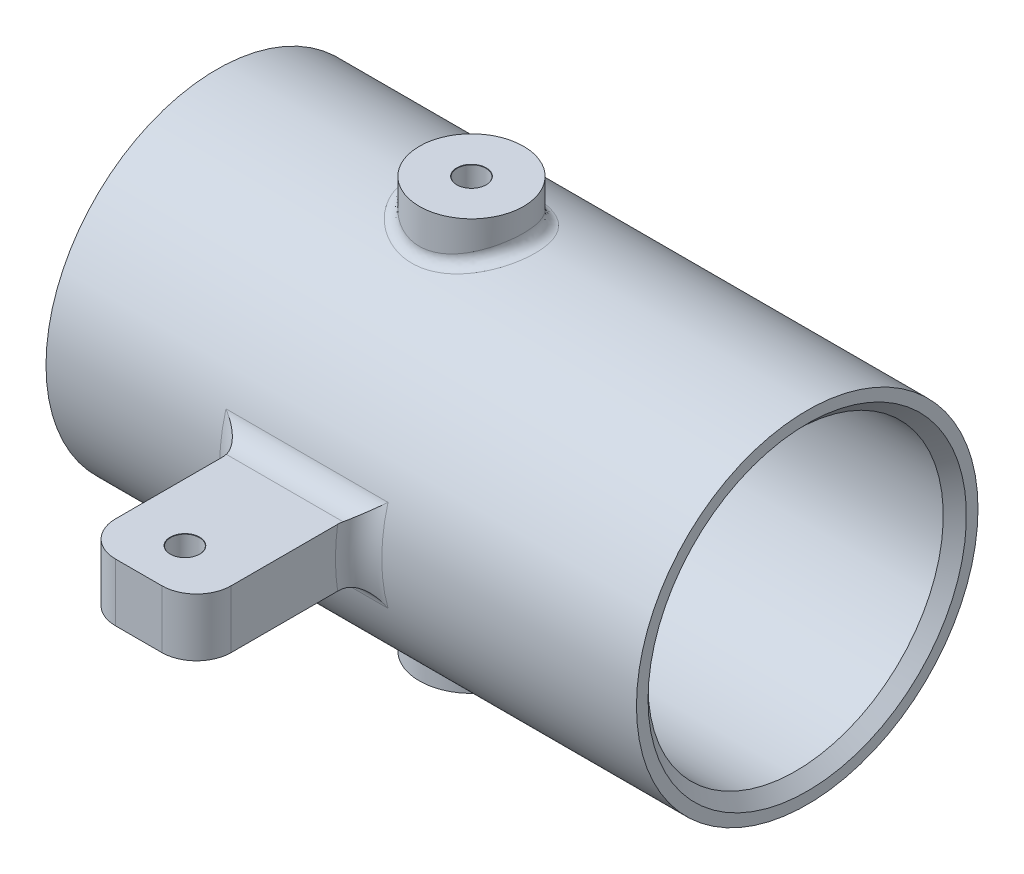
from build123d import *

# Parameters (mm, degrees)
M3_CLEARANCE_HOLE1_AT_2_COUNT = 2
M3_CLEARANCE_HOLE1_AT_2_PITCH = 17
BOSS_EXTRUDE2_START           = -0.703203
SKETCH5_R                     = 4.5
BOSS_EXTRUDE2_DEPTH           = 3.703203
SKETCH6_R                     = 1
CUT_EXTRUDE1_DEPTH            = 63.247992093
FILLET1_R                     = 1
SKETCH7_R                     = 1
BOSS_EXTRUDE3_DEPTH           = 2.5
BOSS_EXTRUDE4_REACH           = 63.533
BOSS_EXTRUDE4_END_RADIUS      = 14.75
SKETCH8_W                     = 10
SKETCH8_H                     = 5
CHAMFER1_SIZE                 = 1
CHAMFER2_SIZE                 = 0.5
FILLET2_R                     = 2


with BuildPart() as part:
    # Sketch1 → Revolve1 (revolve)
    with BuildSketch(Plane.XY, mode=Mode.PRIVATE) as revolve1_sk:
        Polygon((0, 3.75), (0, 14.75), (51, 14.75), (51, 12.75), (2, 12.75), (2, 3.75), align=None)
    revolve(revolve1_sk.sketch.rotate(Axis((-25.375, 0, 0), (1, 0, 0)), 90), axis=Axis((-25.375, 0, 0), (1, 0, 0)))

    # Sketch4 → M3 Clearance Hole1 (revolve, cut)
    with BuildSketch(Plane(origin=(0, 0, -8.5), x_dir=(0, 0, 1), z_dir=(0, 1, 0))):
        Polygon((0, 0), (0, 2), (1.825, 2), (1.8, 1.975), (1.8, 0.025), (1.825, 0), align=None)
    m3_clearance_hole1 = revolve(axis=Axis((-6.35, 0, -8.5), (1, 0, 0)), mode=Mode.SUBTRACT)

    # M3 Clearance Hole1 at 2: M3 Clearance Hole1 ×2
    with Locations(*[(0, 0, i * M3_CLEARANCE_HOLE1_AT_2_PITCH) for i in range(1, M3_CLEARANCE_HOLE1_AT_2_COUNT)]):
        add(m3_clearance_hole1, mode=Mode.SUBTRACT)

    # Sketch5 → Boss-Extrude2 (add)
    with BuildSketch(Plane(origin=(0, 14.75, 0), x_dir=(1, 0, 0), z_dir=(0, 1, 0)).offset(BOSS_EXTRUDE2_START)):
        with Locations(Location((22, 0, 0), (0, 0, 90))):
            Circle(SKETCH5_R)
    boss_extrude2 = extrude(amount=BOSS_EXTRUDE2_DEPTH)

    # Sketch6 → Cut-Extrude1 (cut, through all)
    with BuildSketch(Plane(origin=(0, 17.75, 0), x_dir=(1, 0, 0), z_dir=(0, 1, 0))):
        with Locations(Location((22, 0, 0), (0, 0, 270))):
            Circle(SKETCH6_R)
    cut_extrude1 = extrude(amount=-CUT_EXTRUDE1_DEPTH, mode=Mode.SUBTRACT)

    # Mirror1: Boss-Extrude2, Cut-Extrude1 across plane
    add(boss_extrude2.mirror(Plane.ZX))
    add(cut_extrude1.mirror(Plane.ZX), mode=Mode.SUBTRACT)

    # Fillet1
    fillet1_edges = [part.edges().sort_by_distance(p)[0] for p in [
        (22, 14.04679679, 4.499999998),
        (22, -14.04679679, 4.499999998),
    ]]
    fillet(fillet1_edges, radius=FILLET1_R)



with BuildPart() as body_2:
    # Sketch7 → Boss-Extrude3 (new, symmetric)
    with BuildSketch(Plane(origin=(0, 0, 0), x_dir=(1, 0, 0), z_dir=(0, 1, 0))):
        with BuildLine():
            Line((17, -14.75), (17, -25.75))
            ThreePointArc((17, -25.75), (17.878679656, -27.871320344), (20, -28.75))
            Line((20, -28.75), (24, -28.75))
            ThreePointArc((24, -28.75), (26.121320344, -27.871320344), (27, -25.75))
            Line((27, -25.75), (27, -14.75))
            Line((27, -14.75), (17, -14.75))
        make_face()
        with Locations(Location((22, -24.75, 0), (0, 0, 270))):
            Circle(SKETCH7_R, mode=Mode.SUBTRACT)
    extrude(amount=BOSS_EXTRUDE3_DEPTH, both=True)


with BuildPart() as part_1:
    add(part.part)

    add(body_2.part)  # Boss-Extrude4 merges body 2
    # Boss-Extrude4: up to this cylinder (the profile starts outside it)
    boss_extrude4_end = Plane(origin=(22, 0, 0), z_dir=(-1, 0, 0)) * Cylinder(BOSS_EXTRUDE4_END_RADIUS, 157.566, mode=Mode.PRIVATE)
    # Sketch8 → Boss-Extrude4 (add, up to the surface)
    with BuildSketch(Plane(origin=(0, 0, 14.75), x_dir=(-1, 0, 0), z_dir=(0, 0, -1)), mode=Mode.PRIVATE) as boss_extrude4_sk1:
        with Locations((-22, 0)):
            Rectangle(SKETCH8_W, SKETCH8_H)
    boss_extrude4_tool1 = extrude(boss_extrude4_sk1.sketch, amount=BOSS_EXTRUDE4_REACH, mode=Mode.PRIVATE) - boss_extrude4_end
    add(boss_extrude4_tool1.solids().sort_by_distance((22, 0, 14.75))[0])
    add(boss_extrude4_tool1.solids().sort_by_distance((22, 0, 14.75))[1])

    # Sketch11 → Tap Drill for M3x0.5 Tap2 (revolve, cut)
    with BuildSketch(Plane(origin=(22, 17.75, 0), x_dir=(0, 0, 1), z_dir=(1, 0, 0))):
        Polygon((0, 0), (0, 35.5), (1.275, 35.5), (1.25, 35.475), (1.25, 0.025), (1.275, 0), align=None)
    revolve(axis=Axis((22, 24.1, 0), (0, -1, 0)), mode=Mode.SUBTRACT)

    # Sketch13 → Tap Drill for M3x0.5 Tap1 (revolve, cut)
    with BuildSketch(Plane(origin=(22, 2.5, 24.75), x_dir=(0, 0, 1), z_dir=(1, 0, 0))):
        Polygon((0, 0), (0, 20.25), (1.275, 20.25), (1.25, 20.225), (1.25, 0.025), (1.275, 0), align=None)
    revolve(axis=Axis((22, 8.85, 24.75), (0, -1, 0)), mode=Mode.SUBTRACT)

    # Chamfer1
    chamfer1_edges = [part_1.edges().sort_by_distance(p)[0] for p in [
        (51, 0, -12.75),
    ]]
    chamfer(chamfer1_edges, length=CHAMFER1_SIZE)

    # Chamfer2
    chamfer2_edges = [part_1.edges().sort_by_distance(p)[0] for p in [
        (2, 0, -3.75),
        (0, 0, -3.75),
    ]]
    chamfer(chamfer2_edges, length=CHAMFER2_SIZE)

    # Fillet2
    fillet2_edges = [part_1.edges().sort_by_distance(p)[0] for p in [
        (22, 2.5, 14.53659176),
        (27, -1.254546041, 14.6965511),
        (17, -1.254546041, 14.6965511),
        (22, -2.5, 14.53659176),
    ]]
    fillet(fillet2_edges, radius=FILLET2_R)


solid = part_1.part
